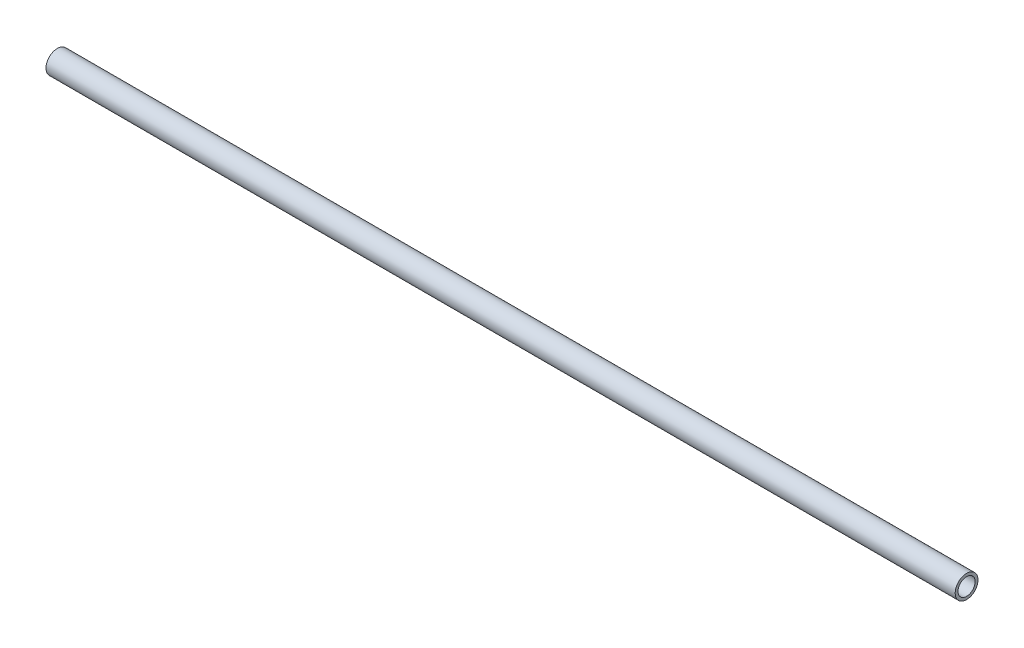
from build123d import *

# Parameters (mm, degrees)
SKETCH2_R           = 8
SKETCH2_R_2         = 6
BOSS_EXTRUDE1_DEPTH = 638


with BuildPart() as part:
    # Sketch2 → Boss-Extrude1 (new body)
    with BuildSketch(Plane(origin=(0, 0, 0), x_dir=(0, 0, -1), z_dir=(1, 0, 0))):
        Circle(SKETCH2_R)
        Circle(SKETCH2_R_2, mode=Mode.SUBTRACT)
    extrude(amount=BOSS_EXTRUDE1_DEPTH)


solid = part.part
